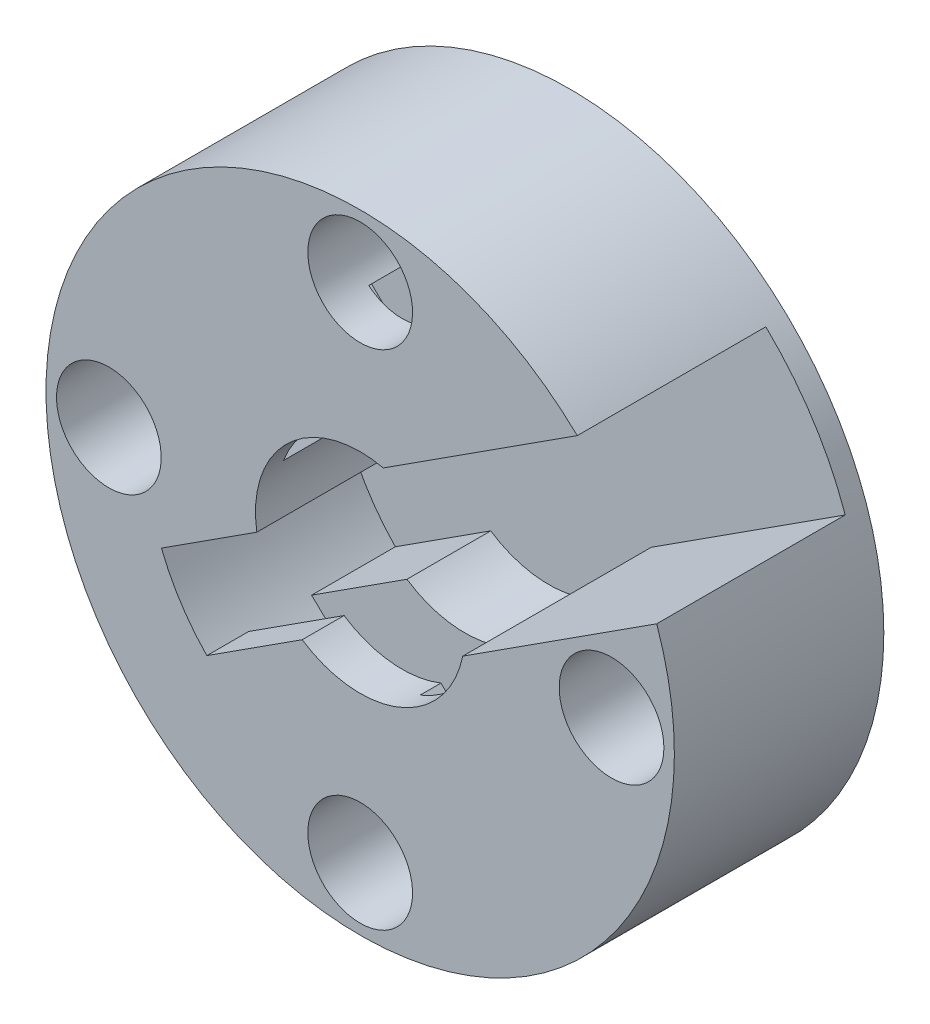
from build123d import *

# Parameters (mm, degrees)
SKETCH1_R                = 15
BOSS_EXTRUDE1_DEPTH      = 10
SKETCH1_3_R              = 1.1
SCREWTHREAD_CUTOUT_DEPTH = 24.452078799
SCREW_START              = 4
SKETCH1_4_R              = 2.5
SCREW_HEAD_CUTOUT_DEPTH  = 20.452078799
CIRPATTERN1_COUNT        = 4
CUT_EXTRUDE3_START       = 1
CUT_EXTRUDE3_DEPTH       = 23.452078799
CUT_EXTRUDE4_START       = 5
CUT_EXTRUDE4_DEPTH       = 3
CUT_EXTRUDE11_START      = 1
CUT_EXTRUDE11_DEPTH      = 8


with BuildPart() as part:
    # Sketch1 → Boss-Extrude1 (new body)
    with BuildSketch(Plane.XY):
        Circle(SKETCH1_R)
    extrude(amount=BOSS_EXTRUDE1_DEPTH)

    # Sketch1<3> → screwthread cutout (cut, through all)
    with BuildSketch(Plane.XY):
        with Locations((12, 0)):
            Circle(SKETCH1_3_R)
    screwthread_cutout = extrude(amount=SCREWTHREAD_CUTOUT_DEPTH, mode=Mode.SUBTRACT)

    # Sketch1<4> → screw head cutout (cut, through all)
    with BuildSketch(Plane.XY.offset(SCREW_START)):
        with Locations((12, 0)):
            Circle(SKETCH1_4_R)
    screw_head_cutout = extrude(amount=SCREW_HEAD_CUTOUT_DEPTH, mode=Mode.SUBTRACT)

    # CirPattern1: screwthread cutout, screw head cutout ×4 about axis
    cirpattern1_axis = Axis((0, 0, 10), (0, 0, -1))
    add([screwthread_cutout.rotate(cirpattern1_axis, i * 360 / CIRPATTERN1_COUNT) for i in range(1, CIRPATTERN1_COUNT)], mode=Mode.SUBTRACT)
    add([screw_head_cutout.rotate(cirpattern1_axis, i * 360 / CIRPATTERN1_COUNT) for i in range(1, CIRPATTERN1_COUNT)], mode=Mode.SUBTRACT)

    # Sketch2 → Cut-Extrude3 (cut, through all)
    with BuildSketch(Plane.XY.offset(CUT_EXTRUDE3_START)):
        with BuildLine():
            ThreePointArc((-9.489267084, -3.735479917), (-8.572404045, -5.523937806), (-7.322600417, -7.097853417))
            Line((-7.322600417, -7.097853417), (-2.768749437, -4.163415252))
            ThreePointArc((-2.768749437, -4.163415252), (1.903153532, -4.623635651), (4.897352046, -1.007939947))
            Line((4.897352046, -1.007939947), (14.925030647, 5.453756521))
            Line((14.925030647, 5.453756521), (11.13336398, 11.337910146))
            Line((11.13336398, 11.337910146), (1.105685379, 4.876213679))
            ThreePointArc((1.105685379, 4.876213679), (-3.424108155, 3.643553669), (-4.935416103, -0.801041751))
            Line((-4.935416103, -0.801041751), (-9.489267084, -3.735479917))
        make_face()
    extrude(amount=CUT_EXTRUDE3_DEPTH, mode=Mode.SUBTRACT)

    # Sketch2<4> → Cut-Extrude4 (cut)
    with BuildSketch(Plane.XY.offset(CUT_EXTRUDE4_START)):
        with BuildLine():
            Line((-9.489267084, -3.735479917), (-7.322600417, -7.097853417))
            ThreePointArc((-7.322600417, -7.097853417), (-1.050685684, -10.143769496), (5.712369236, -8.448007914))
            Line((5.712369236, -8.448007914), (8.522190031, -5.601096061))
            Line((8.522190031, -5.601096061), (3.180991239, -0.329485203))
            Line((3.180991239, -0.329485203), (9.489267084, 3.735479917))
            Line((9.489267084, 3.735479917), (7.322600417, 7.097853417))
            ThreePointArc((7.322600417, 7.097853417), (1.050685684, 10.143769496), (-5.712369236, 8.448007914))
            Line((-5.712369236, 8.448007914), (-8.522190031, 5.601096061))
            Line((-8.522190031, 5.601096061), (-3.180991239, 0.329485203))
            Line((-3.180991239, 0.329485203), (-9.489267084, -3.735479917))
        make_face()
    extrude(amount=CUT_EXTRUDE4_DEPTH, mode=Mode.SUBTRACT)

    # Sketch2<5> → Cut-Extrude11 (cut)
    with BuildSketch(Plane.XY.offset(CUT_EXTRUDE11_START)):
        Polygon((5.712369236, -8.448007914), (-8.522190031, 5.601096061), (-5.712369236, 8.448007914), (8.522190031, -5.601096061), align=None)
    extrude(amount=CUT_EXTRUDE11_DEPTH, mode=Mode.SUBTRACT)


solid = part.part
